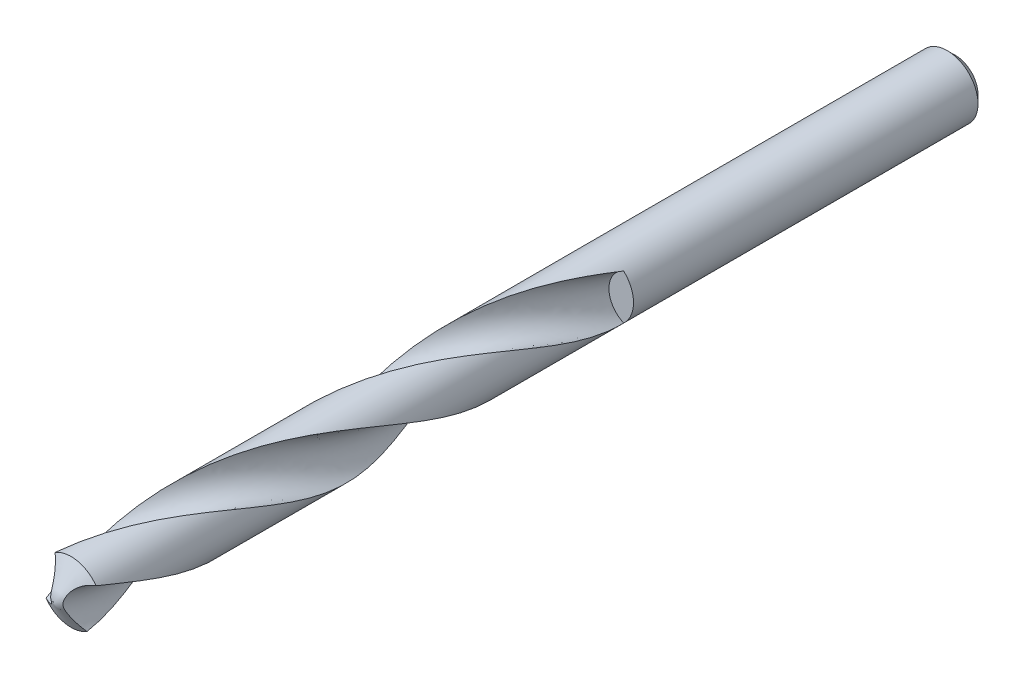
from build123d import *

# Parameters (mm, degrees)
SKETCH_1_R               = 3.75
EXTRUDE_1_DEPTH          = 110
SWEEP_1_PITCH            = 67
SWEEP_1_HEIGHT           = 67
SWEEP_1_RADIUS           = 3.75
SKETCH_4_R               = 3
PATTERN_CIRCULAR_1_COUNT = 2
CHAMFER_1_SIZE           = 1


with BuildPart() as part:
    # 草圖1 → 填料-伸長1 (new body)
    with BuildSketch(Plane.XY):
        Circle(SKETCH_1_R)
    extrude(amount=EXTRUDE_1_DEPTH)

    # 除料-掃出1: sweep along a helix
    with BuildLine() as sweep_1_path:
        Helix(SWEEP_1_PITCH, SWEEP_1_HEIGHT, SWEEP_1_RADIUS, center=(0, 0, 110), direction=(0, 0, -1))
    # 草圖4 → 除料-掃出1 (sweep, cut)
    with BuildSketch(Plane.XY.offset(110)):
        with Locations((-3.75, 0)):
            Circle(SKETCH_4_R)
    sweep_1 = sweep(path=sweep_1_path.line, is_frenet=True, mode=Mode.SUBTRACT)

    # 環狀複製排列1: 除料-掃出1 ×2 about axis
    pattern_circular_1_axis = Axis((0, 0, 110), (0, 0, -1))
    for i in range(1, PATTERN_CIRCULAR_1_COUNT):
        add(sweep_1.rotate(pattern_circular_1_axis, i * 360 / PATTERN_CIRCULAR_1_COUNT), mode=Mode.SUBTRACT)

    # 草圖5 → 除料-旋轉1 (revolve, cut)
    with BuildSketch(Plane(origin=(0, 0, 0), x_dir=(1, 0, 0), z_dir=(0, 1, 0)), mode=Mode.PRIVATE) as cut_revolve_1_sk:
        Polygon((0, -110), (-8.701457679, -104.976211067), (-8.701457679, -119.185631954), (0, -119.185631954), align=None)
    revolve(cut_revolve_1_sk.sketch.rotate(Axis((0, 0, 110), (0, 0, -1)), 324.475595026), axis=Axis((0, 0, 110), (0, 0, -1)), mode=Mode.SUBTRACT)

    # 導角1
    chamfer_1_edges = [part.edges().sort_by_distance(p)[0] for p in [
        (-3.75, 0, 0),
    ]]
    chamfer(chamfer_1_edges, length=CHAMFER_1_SIZE)


solid = part.part
